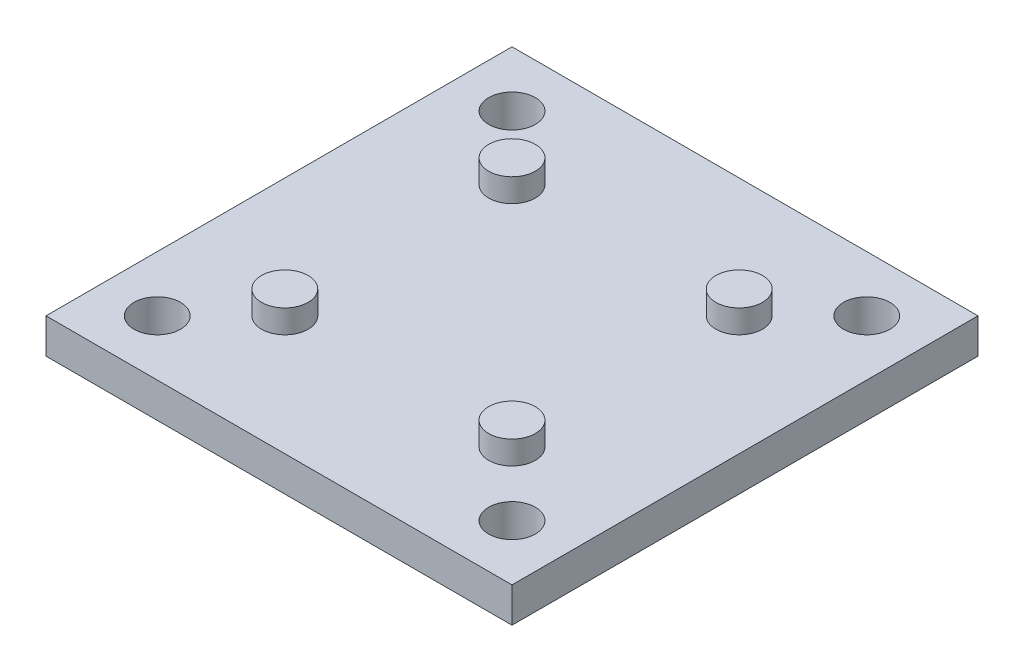
from build123d import *

# Parameters (mm, degrees)
SKETCH_2_W          = 40
SKETCH_2_H          = 40
EXTRUDE_2_DEPTH     = 3
SKETCH_3_R          = 2
CUT_EXTRUDE_1_DEPTH = 3
SKETCH_2_6_R        = 2
EXTRUDE_3_DEPTH     = 5


with BuildPart() as part:
    # 草图2 → 凸台-拉伸2 (new body)
    with BuildSketch(Plane(origin=(0, 0, 0), x_dir=(1, 0, 0), z_dir=(0, 1, 0))):
        Rectangle(SKETCH_2_W, SKETCH_2_H)
    extrude(amount=EXTRUDE_2_DEPTH)

    # 草图3 → 切除-拉伸1 (cut)
    with BuildSketch(Plane(origin=(0, 0, 0), x_dir=(1, 0, 0), z_dir=(0, 1, 0))):
        with Locations((-15.224798987, -15.224798987)):
            Circle(SKETCH_3_R)
        with Locations((15.224798987, -15.224798987)):
            Circle(SKETCH_3_R)
        with Locations((15.224798987, 15.224798987)):
            Circle(SKETCH_3_R)
        with Locations((-15.224798987, 15.224798987)):
            Circle(SKETCH_3_R)
    extrude(amount=CUT_EXTRUDE_1_DEPTH, mode=Mode.SUBTRACT)

    # 草图2<6> → 凸台-拉伸3 (add)
    with BuildSketch(Plane(origin=(0, 0, 0), x_dir=(1, 0, 0), z_dir=(0, 1, 0))):
        with Locations((9.75, 9.75)):
            Circle(SKETCH_2_6_R)
        with Locations((-9.75, 9.75)):
            Circle(SKETCH_2_6_R)
        with Locations((9.75, -9.75)):
            Circle(SKETCH_2_6_R)
        with Locations((-9.75, -9.75)):
            Circle(SKETCH_2_6_R)
    extrude(amount=EXTRUDE_3_DEPTH)


solid = part.part
